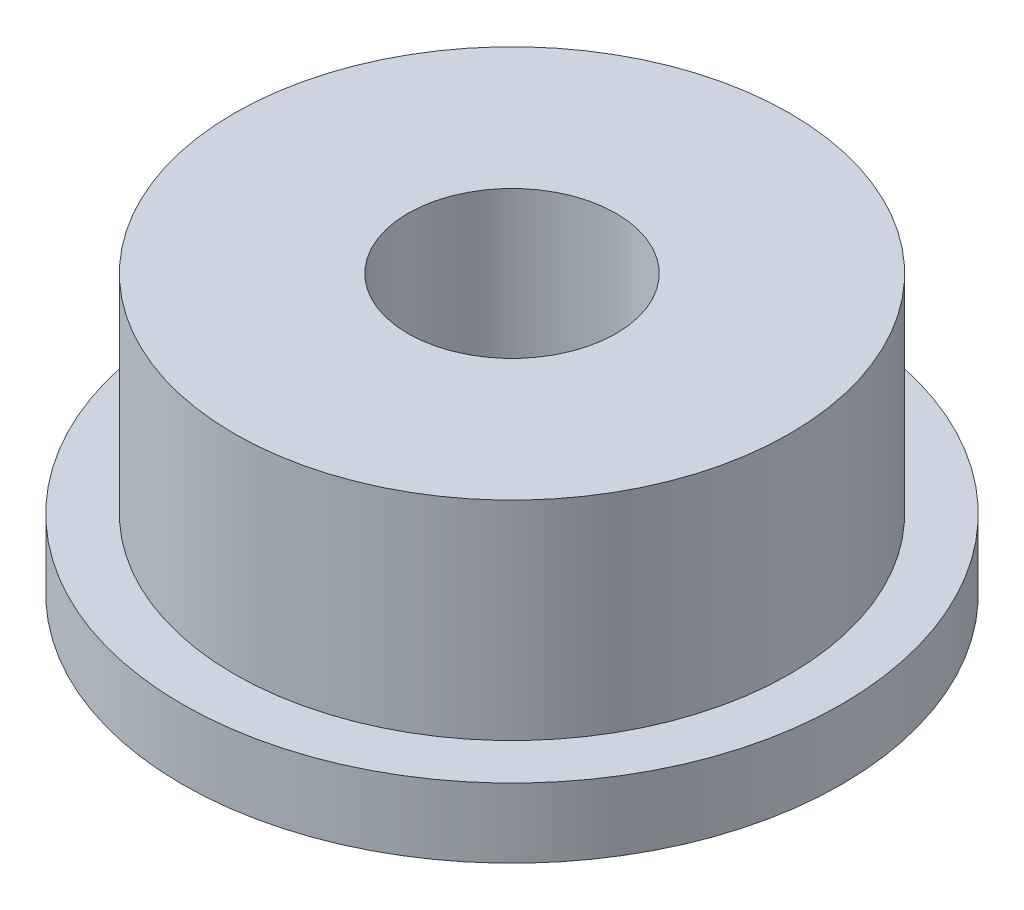
from build123d import *

# Parameters (mm, degrees)
SKETCH_1_R      = 4.75
SKETCH_1_R_2    = 1.5
EXTRUDE_1_DEPTH = 1
SKETCH_2_R      = 4
SKETCH_2_R_2    = 1.5
EXTRUDE_2_DEPTH = 3


with BuildPart() as part:
    # 草图1 → 凸台-拉伸1 (new body)
    with BuildSketch(Plane(origin=(0, 0, 0), x_dir=(1, 0, 0), z_dir=(0, 1, 0))):
        with Locations(Location((0, 0, 0), (0, 0, 270))):
            Circle(SKETCH_1_R)
        with Locations(Location((0, 0, 0), (0, 0, 270))):
            Circle(SKETCH_1_R_2, mode=Mode.SUBTRACT)
    extrude(amount=EXTRUDE_1_DEPTH)

    # 草图2 → 凸台-拉伸2 (add)
    with BuildSketch(Plane(origin=(0, 1, 0), x_dir=(1, 0, 0), z_dir=(0, 1, 0))):
        with Locations(Location((0, 0, 0), (0, 0, 270))):
            Circle(SKETCH_2_R)
        with Locations(Location((0, 0, 0), (0, 0, 270))):
            Circle(SKETCH_2_R_2, mode=Mode.SUBTRACT)
    extrude(amount=EXTRUDE_2_DEPTH)


solid = part.part
